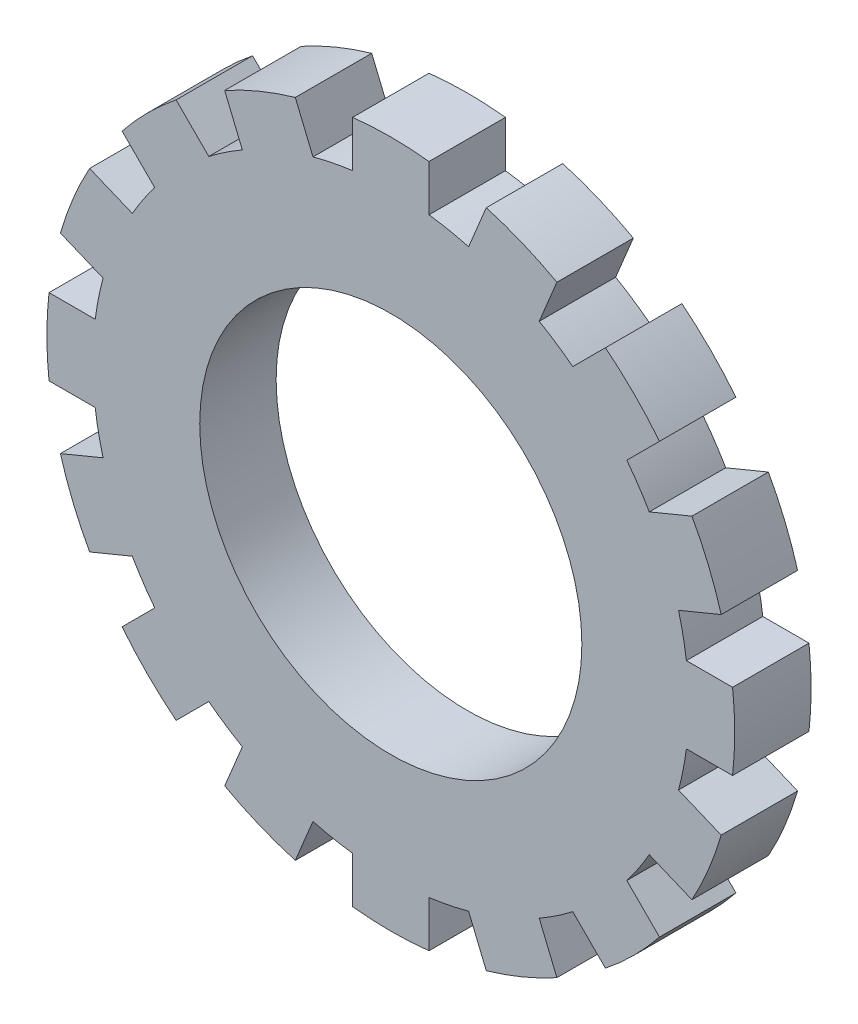
from build123d import *

# Parameters (mm, degrees)
SKETCH2_R           = 25
BOSS_EXTRUDE1_DEPTH = 10


with BuildPart() as part:
    # Sketch2 → Boss-Extrude1 (new body)
    with BuildSketch(Plane.XY):
        with BuildLine():
            Line((38.678159212, 5), (44.72135955, 5))
            ThreePointArc((44.72135955, 5), (45, 0), (44.72135955, -5))
            Line((44.72135955, -5), (38.678159212, -5))
            ThreePointArc((38.678159212, -5), (38.250625936, -7.608522559), (37.647376813, -10.182093062))
            Line((37.647376813, -10.182093062), (43.230565916, -12.49472571))
            ThreePointArc((43.230565916, -12.49472571), (41.574578963, -17.220754456), (39.403731592, -21.733521035))
            Line((39.403731592, -21.733521035), (33.820542489, -19.420888387))
            ThreePointArc((33.820542489, -19.420888387), (32.42731488, -21.667239088), (30.885122568, -23.814054756))
            Line((30.885122568, -23.814054756), (35.158310508, -28.087242696))
            ThreePointArc((35.158310508, -28.087242696), (31.819805153, -31.819805153), (28.087242696, -35.158310508))
            Line((28.087242696, -35.158310508), (23.814054756, -30.885122568))
            ThreePointArc((23.814054756, -30.885122568), (21.667239088, -32.42731488), (19.420888387, -33.820542489))
            Line((19.420888387, -33.820542489), (21.733521035, -39.403731592))
            ThreePointArc((21.733521035, -39.403731592), (17.220754456, -41.574578963), (12.49472571, -43.230565916))
            Line((12.49472571, -43.230565916), (10.182093062, -37.647376813))
            ThreePointArc((10.182093062, -37.647376813), (7.608522559, -38.250625936), (5, -38.678159212))
            Line((5, -38.678159212), (5, -44.72135955))
            ThreePointArc((5, -44.72135955), (0, -45), (-5, -44.72135955))
            Line((-5, -44.72135955), (-5, -38.678159212))
            ThreePointArc((-5, -38.678159212), (-7.608522559, -38.250625936), (-10.182093062, -37.647376813))
            Line((-10.182093062, -37.647376813), (-12.49472571, -43.230565916))
            ThreePointArc((-12.49472571, -43.230565916), (-17.220754456, -41.574578963), (-21.733521035, -39.403731592))
            Line((-21.733521035, -39.403731592), (-19.420888387, -33.820542489))
            ThreePointArc((-19.420888387, -33.820542489), (-21.667239088, -32.42731488), (-23.814054756, -30.885122568))
            Line((-23.814054756, -30.885122568), (-28.087242696, -35.158310508))
            ThreePointArc((-28.087242696, -35.158310508), (-31.819805153, -31.819805153), (-35.158310508, -28.087242696))
            Line((-35.158310508, -28.087242696), (-30.885122568, -23.814054756))
            ThreePointArc((-30.885122568, -23.814054756), (-32.42731488, -21.667239088), (-33.820542489, -19.420888387))
            Line((-33.820542489, -19.420888387), (-39.403731592, -21.733521035))
            ThreePointArc((-39.403731592, -21.733521035), (-41.574578963, -17.220754456), (-43.230565916, -12.49472571))
            Line((-43.230565916, -12.49472571), (-37.647376813, -10.182093062))
            ThreePointArc((-37.647376813, -10.182093062), (-38.250625936, -7.608522559), (-38.678159212, -5))
            Line((-38.678159212, -5), (-44.72135955, -5))
            ThreePointArc((-44.72135955, -5), (-45, 0), (-44.72135955, 5))
            Line((-44.72135955, 5), (-38.678159212, 5))
            ThreePointArc((-38.678159212, 5), (-38.250625936, 7.608522559), (-37.647376813, 10.182093062))
            Line((-37.647376813, 10.182093062), (-43.230565916, 12.49472571))
            ThreePointArc((-43.230565916, 12.49472571), (-41.574578963, 17.220754456), (-39.403731592, 21.733521035))
            Line((-39.403731592, 21.733521035), (-33.820542489, 19.420888387))
            ThreePointArc((-33.820542489, 19.420888387), (-32.42731488, 21.667239088), (-30.885122568, 23.814054756))
            Line((-30.885122568, 23.814054756), (-35.158310508, 28.087242696))
            ThreePointArc((-35.158310508, 28.087242696), (-31.819805153, 31.819805153), (-28.087242696, 35.158310508))
            Line((-28.087242696, 35.158310508), (-23.814054756, 30.885122568))
            ThreePointArc((-23.814054756, 30.885122568), (-21.667239088, 32.42731488), (-19.420888387, 33.820542489))
            Line((-19.420888387, 33.820542489), (-21.733521035, 39.403731592))
            ThreePointArc((-21.733521035, 39.403731592), (-17.220754456, 41.574578963), (-12.49472571, 43.230565916))
            Line((-12.49472571, 43.230565916), (-10.182093062, 37.647376813))
            ThreePointArc((-10.182093062, 37.647376813), (-7.608522559, 38.250625936), (-5, 38.678159212))
            Line((-5, 38.678159212), (-5, 44.72135955))
            ThreePointArc((-5, 44.72135955), (0, 45), (5, 44.72135955))
            Line((5, 44.72135955), (5, 38.678159212))
            ThreePointArc((5, 38.678159212), (7.608522559, 38.250625936), (10.182093062, 37.647376813))
            Line((10.182093062, 37.647376813), (12.49472571, 43.230565916))
            ThreePointArc((12.49472571, 43.230565916), (17.220754456, 41.574578963), (21.733521035, 39.403731592))
            Line((21.733521035, 39.403731592), (19.420888387, 33.820542489))
            ThreePointArc((19.420888387, 33.820542489), (21.667239088, 32.42731488), (23.814054756, 30.885122568))
            Line((23.814054756, 30.885122568), (28.087242696, 35.158310508))
            ThreePointArc((28.087242696, 35.158310508), (31.819805153, 31.819805153), (35.158310508, 28.087242696))
            Line((35.158310508, 28.087242696), (30.885122568, 23.814054756))
            ThreePointArc((30.885122568, 23.814054756), (32.42731488, 21.667239088), (33.820542489, 19.420888387))
            Line((33.820542489, 19.420888387), (39.403731592, 21.733521035))
            ThreePointArc((39.403731592, 21.733521035), (41.574578963, 17.220754456), (43.230565916, 12.49472571))
            Line((43.230565916, 12.49472571), (37.647376813, 10.182093062))
            ThreePointArc((37.647376813, 10.182093062), (38.250625936, 7.608522559), (38.678159212, 5))
        make_face()
        Circle(SKETCH2_R, mode=Mode.SUBTRACT)
    extrude(amount=BOSS_EXTRUDE1_DEPTH)


solid = part.part
